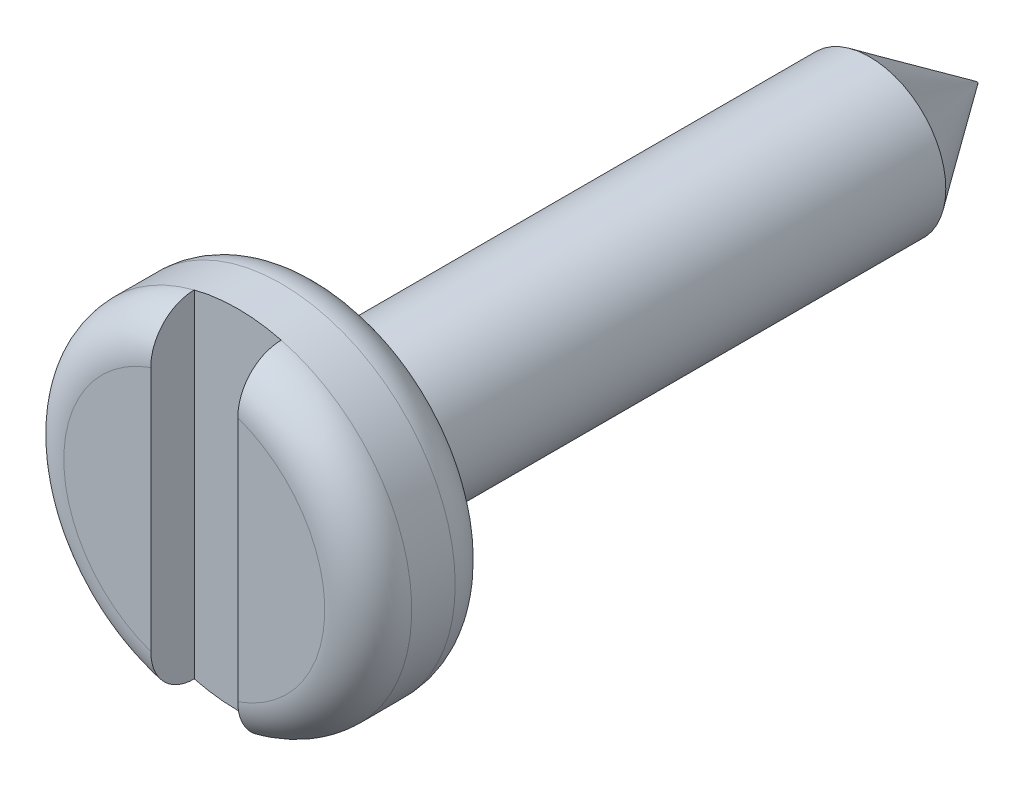
from build123d import *

# Parameters (mm, degrees)
CROQUIS1_R              = 4
SALIENTE_EXTRUIR1_DEPTH = 3
REDONDEO1_R             = 1
CROQUIS2_W              = 2
CROQUIS2_H              = 10.515557436
CORTAR_EXTRUIR1_DEPTH   = 1
CROQUIS3_R              = 1.75
SALIENTE_EXTRUIR2_DEPTH = 15
CHAFL_N1_SIZE           = 2.47
CHAFL_N1_SIZE2          = 1.729512619


with BuildPart() as part:
    # Croquis1 → Saliente-Extruir1 (new body)
    with BuildSketch(Plane.XY):
        Circle(CROQUIS1_R)
    extrude(amount=SALIENTE_EXTRUIR1_DEPTH)

    # Redondeo1
    redondeo1_edges = [part.edges().sort_by_distance(p)[0] for p in [
        (-4, 0, 0),
        (-4, 0, 3),
    ]]
    fillet(redondeo1_edges, radius=REDONDEO1_R)

    # Croquis2 → Cortar-Extruir1 (cut)
    with BuildSketch(Plane.XY.offset(3)):
        Rectangle(CROQUIS2_W, CROQUIS2_H)
    extrude(amount=-CORTAR_EXTRUIR1_DEPTH, mode=Mode.SUBTRACT)

    # Croquis3 → Saliente-Extruir2 (add)
    with BuildSketch(Plane(origin=(0, 0, 0), x_dir=(-1, 0, 0), z_dir=(0, 0, -1))):
        with Locations(Location((0, 0, 0), (0, 0, 180))):
            Circle(CROQUIS3_R)
    extrude(amount=SALIENTE_EXTRUIR2_DEPTH)

    # Chaflán1
    chafl_n1_edges = [part.edges().sort_by_distance(p)[0] for p in [
        (-1.75, 0, -15),
    ]]
    chafl_n1_side = [part.faces().sort_by_distance(p)[0] for p in [
        (-1.75, 0, -7.5),
    ]]
    chamfer(chafl_n1_edges, length=CHAFL_N1_SIZE, length2=CHAFL_N1_SIZE2, reference=chafl_n1_side[0])


solid = part.part
